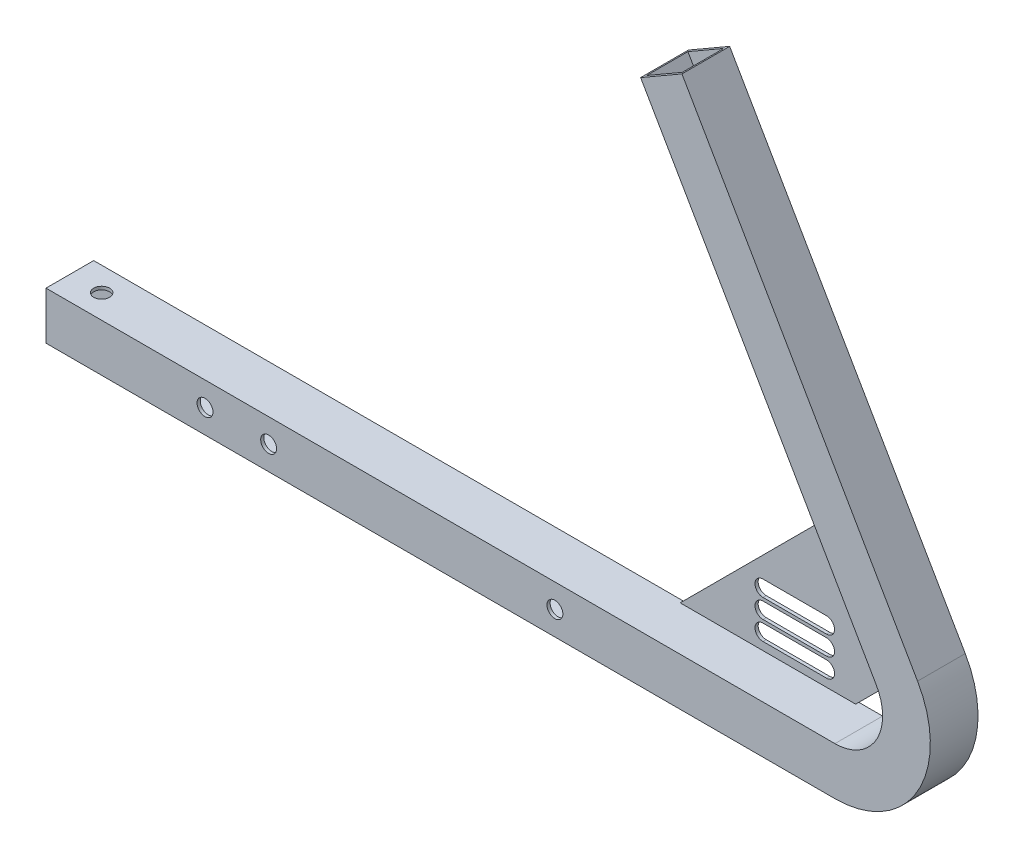
from build123d import *

# Parameters (mm, degrees)
BOSS_EXTRUDE1_DEPTH     = 38.1
SHELL1_T                = -2.54
CUT_EXTRUDE1_REACH      = 782.53
SKETCH3_W               = 33.02
SKETCH3_H               = 33.02
SKETCH5_R               = 6.35
CUT_EXTRUDE2_DEPTH      = 575.603362093
BOSS_EXTRUDE4_START     = -2.54
BOSS_EXTRUDE4_DEPTH     = 2.54
SKETCH8_W               = 38.1
SKETCH8_H               = 38.1
SKETCH8_W_2             = 33.02
SKETCH8_H_2             = 33.02
BOSS_EXTRUDE5_DEPTH     = 127
CUT_EXTRUDE3_REACH      = 620.716
SKETCH9_R               = 6.35
CUT_EXTRUDE5_DEPTH      = 645.127329931
CUT_EXTRUDE5_DEPTH_BACK = 645.127329931
CUT_EXTRUDE6_REACH      = 646.127
SKETCH12_R              = 6.35


with BuildPart() as part:
    # Sketch1 → Boss-Extrude1 (new body)
    with BuildSketch(Plane.XY):
        with BuildLine():
            Line((102.652877862, 330.2), (227.30280098, 114.3))
            ThreePointArc((227.30280098, 114.3), (227.30280098, 38.1), (161.311665212, 0))
            Line((161.311665212, 0), (-468.706063252, 0))
            Line((-468.706063252, 0), (-468.706063252, 38.1))
            Line((-468.706063252, 38.1), (161.311665212, 38.1))
            ThreePointArc((161.311665212, 38.1), (194.307233096, 57.15), (194.307233096, 95.25))
            Line((194.307233096, 95.25), (69.657309978, 311.15))
            Line((69.657309978, 311.15), (102.652877862, 330.2))
        make_face()
    extrude(amount=-BOSS_EXTRUDE1_DEPTH)

    # Shell1
    shell1_openings = [part.faces().sort_by_distance(p)[0] for p in [
        (86.15509392, 320.675, -19.05),
    ]]
    offset(amount=SHELL1_T, openings=shell1_openings, kind=Kind.INTERSECTION)

    # Sketch3 → Cut-Extrude1 (cut, up to next)
    with BuildSketch(Plane.ZY.offset(468.706063252), mode=Mode.PRIVATE) as cut_extrude1_sk1:
        with Locations((-19.05, 19.05)):
            Rectangle(SKETCH3_W, SKETCH3_H)
    cut_extrude1_tool1 = extrude(cut_extrude1_sk1.sketch, amount=-CUT_EXTRUDE1_REACH, mode=Mode.PRIVATE) & part.part
    add(cut_extrude1_tool1.solids().sort_by_distance((-468.706063, 19.05, -19.05))[0], mode=Mode.SUBTRACT)

    # Sketch5 → Cut-Extrude2 (cut, through all)
    with BuildSketch(Plane.XY):
        with Locations((-62.306063252, 19.05)):
            Circle(SKETCH5_R)
        with Locations((-290.906063252, 19.05)):
            Circle(SKETCH5_R)
        with Locations((-341.706063252, 19.05)):
            Circle(SKETCH5_R)
    extrude(amount=-CUT_EXTRUDE2_DEPTH, mode=Mode.SUBTRACT)

    # Sketch7 → Boss-Extrude4 (add)
    with BuildSketch(Plane(origin=(0, 0, -38.1), x_dir=(-1, 0, 0), z_dir=(0, 0, -1)).offset(BOSS_EXTRUDE4_START)):
        with BuildLine():
            Line((-144.901761863, 180.822786347), (-194.307233096, 95.25))
            ThreePointArc((-194.307233096, 95.25), (-195.223150297, 93.567244437), (-196.053318226, 91.840573706))
            Line((-196.053318226, 91.840573706), (-142.31274452, 38.1))
            Line((-142.31274452, 38.1), (-2.178975516, 38.1))
            Line((-2.178975516, 38.1), (-144.901761863, 180.822786347))
        make_face()
    extrude(amount=BOSS_EXTRUDE4_DEPTH)

    # Sketch8 → Boss-Extrude5 (add)
    with BuildSketch(Plane(origin=(-117.317574699, 203.2, 0), x_dir=(0.8660254037844362, 0.5000000000000044, 0), z_dir=(-0.5000000000000044, 0.8660254037844362, 0))):
        with Locations((234.95, 19.05)):
            Rectangle(SKETCH8_W, SKETCH8_H)
        with Locations((234.95, 19.05)):
            Rectangle(SKETCH8_W_2, SKETCH8_H_2, mode=Mode.SUBTRACT)
    extrude(amount=BOSS_EXTRUDE5_DEPTH)

    # Sketch9 → Cut-Extrude3 (cut, up to next)
    with BuildSketch(Plane(origin=(0, 38.1, 0), x_dir=(1, 0, 0), z_dir=(0, 1, 0)), mode=Mode.PRIVATE) as cut_extrude3_sk1:
        with Locations(Location((-443.306063252, 19.05, 0), (0, 0, 180))):
            Circle(SKETCH9_R)
    cut_extrude3_tool1 = extrude(cut_extrude3_sk1.sketch, amount=-CUT_EXTRUDE3_REACH, mode=Mode.PRIVATE) & part.part
    add(cut_extrude3_tool1.solids().sort_by_distance((-443.306063, 38.1, -19.05))[0], mode=Mode.SUBTRACT)

    # Sketch11 → Cut-Extrude5 (cut, two sides: drawn at the far end of the back side and taken through both)
    with BuildSketch(Plane(origin=(0, 0, -38.1), x_dir=(-1, 0, 0), z_dir=(0, 0, -1)).offset(-CUT_EXTRUDE5_DEPTH_BACK)):
        with BuildLine():
            Line((-119.091720036, 44.45), (-68.291720036, 44.45))
            ThreePointArc((-68.291720036, 44.45), (-61.941720036, 50.8), (-68.291720036, 57.15))
            Line((-68.291720036, 57.15), (-119.091720036, 57.15))
            ThreePointArc((-119.091720036, 57.15), (-125.441720036, 50.8), (-119.091720036, 44.45))
        make_face()
        with BuildLine():
            Line((-68.291720036, 87.63), (-119.091720036, 87.63))
            ThreePointArc((-119.091720036, 87.63), (-125.441720036, 81.28), (-119.091720036, 74.93))
            Line((-119.091720036, 74.93), (-68.291720036, 74.93))
            ThreePointArc((-68.291720036, 74.93), (-61.941720036, 81.28), (-68.291720036, 87.63))
        make_face()
        with BuildLine():
            Line((-68.291720036, 72.39), (-119.091720036, 72.39))
            ThreePointArc((-119.091720036, 72.39), (-125.441720036, 66.04), (-119.091720036, 59.69))
            Line((-119.091720036, 59.69), (-68.291720036, 59.69))
            ThreePointArc((-68.291720036, 59.69), (-61.941720036, 66.04), (-68.291720036, 72.39))
        make_face()
    extrude(amount=CUT_EXTRUDE5_DEPTH + CUT_EXTRUDE5_DEPTH_BACK, mode=Mode.SUBTRACT)

    # Sketch12 → Cut-Extrude6 (cut, up to next)
    with BuildSketch(Plane(origin=(0, 0, -38.1), x_dir=(-1, 0, 0), z_dir=(0, 0, -1)), mode=Mode.PRIVATE) as cut_extrude6_sk1:
        with Locations((-35.366501125, 408.643423165)):
            Circle(SKETCH12_R)
    cut_extrude6_tool1 = extrude(cut_extrude6_sk1.sketch, amount=-CUT_EXTRUDE6_REACH, mode=Mode.PRIVATE) & part.part
    add(cut_extrude6_tool1.solids().sort_by_distance((35.366501, 408.643423, -38.1))[0], mode=Mode.SUBTRACT)


solid = part.part
